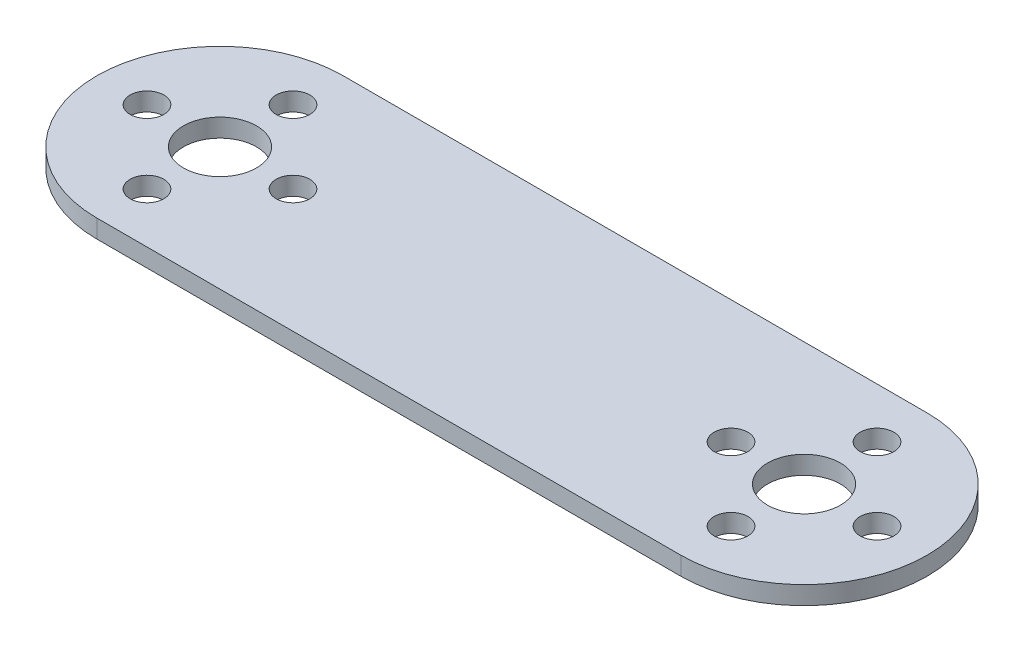
from build123d import *

# Parameters (mm, degrees)
SKETCH1_W           = 91
SKETCH1_H           = 27
BOSS_EXTRUDE1_DEPTH = 2
FILLET1_RADIUS      = 13.5
FILLET1_LENGTH      = 2
FILLET2_RADIUS      = 13.5
FILLET2_LENGTH      = 2
SKETCH2_R           = 4
SKETCH2_R_2         = 1.85
CUT_EXTRUDE1_DEPTH  = 2


with BuildPart() as part:
    # Sketch1 → Boss-Extrude1 (new body)
    with BuildSketch(Plane(origin=(0, 0, 0), x_dir=(1, 0, 0), z_dir=(0, 1, 0))):
        Rectangle(SKETCH1_W, SKETCH1_H)
    extrude(amount=BOSS_EXTRUDE1_DEPTH)

    # Fillet1: full round fillet: the end face becomes a half cylinder, R = half its width
    fillet1_face = Plane((45.5, 1, 0), x_dir=(0, 1, 0), z_dir=(1, 0, 0))  # on the end face: x along it, z out of the body
    fillet1_slab = fillet1_face.offset(-FILLET1_RADIUS / 2) * Box(FILLET1_LENGTH, 2 * FILLET1_RADIUS, FILLET1_RADIUS, mode=Mode.PRIVATE)  # the body's end, R deep
    fillet1_round = Plane((32, 1, 0), x_dir=(1, 0, 0), z_dir=(0, 1, 0)) * Cylinder(FILLET1_RADIUS, FILLET1_LENGTH, mode=Mode.PRIVATE)  # its axis R under the face
    add(fillet1_slab - fillet1_round, mode=Mode.SUBTRACT)

    # Fillet2: full round fillet: the end face becomes a half cylinder, R = half its width
    fillet2_face = Plane((-45.5, 1, 0), x_dir=(0, -1, 0), z_dir=(-1, 0, 0))  # on the end face: x along it, z out of the body
    fillet2_slab = fillet2_face.offset(-FILLET2_RADIUS / 2) * Box(FILLET2_LENGTH, 2 * FILLET2_RADIUS, FILLET2_RADIUS, mode=Mode.PRIVATE)  # the body's end, R deep
    fillet2_round = Plane((-32, 1, 0), x_dir=(-1, 0, 0), z_dir=(0, -1, 0)) * Cylinder(FILLET2_RADIUS, FILLET2_LENGTH, mode=Mode.PRIVATE)  # its axis R under the face
    add(fillet2_slab - fillet2_round, mode=Mode.SUBTRACT)

    # Sketch2 → Cut-Extrude1 (cut)
    with BuildSketch(Plane(origin=(0, 2, 0), x_dir=(1, 0, 0), z_dir=(0, 1, 0))):
        with Locations(Location((-32, 0, 0), (0, 0, 270))):
            Circle(SKETCH2_R)
        with Locations(Location((-24, 0, 0), (0, 0, 270))):
            Circle(SKETCH2_R_2)
        with Locations(Location((-40, 0, 0), (0, 0, 270))):
            Circle(SKETCH2_R_2)
        with Locations(Location((-32, -8, 0), (0, 0, 270))):
            Circle(SKETCH2_R_2)
        with Locations(Location((-32, 8, 0), (0, 0, 270))):
            Circle(SKETCH2_R_2)
        with Locations(Location((32, 0, 0), (0, 0, 270))):
            Circle(SKETCH2_R)
        with Locations(Location((40, 0, 0), (0, 0, 270))):
            Circle(SKETCH2_R_2)
        with Locations(Location((24, 0, 0), (0, 0, 270))):
            Circle(SKETCH2_R_2)
        with Locations(Location((32, -8, 0), (0, 0, 270))):
            Circle(SKETCH2_R_2)
        with Locations(Location((32, 8, 0), (0, 0, 270))):
            Circle(SKETCH2_R_2)
    extrude(amount=-CUT_EXTRUDE1_DEPTH, mode=Mode.SUBTRACT)


solid = part.part
